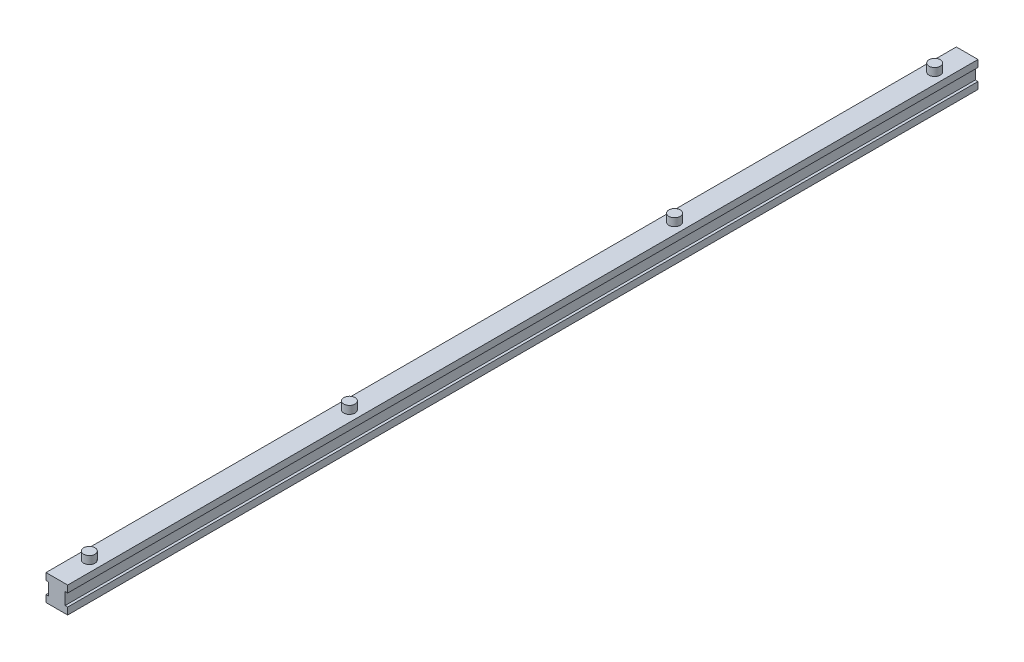
from build123d import *

# Parameters (mm, degrees)
SKETCH1_W           = 2.5
SKETCH1_H           = 105
BOSS_EXTRUDE1_DEPTH = 0.8
SKETCH2_W           = 1.9
SKETCH2_H           = 105
BOSS_EXTRUDE2_DEPTH = 1.4
SKETCH3_W           = 2.5
SKETCH3_H           = 105
BOSS_EXTRUDE3_DEPTH = 0.8
SKETCH4_R           = 0.65
BOSS_EXTRUDE4_DEPTH = 0.9


with BuildPart() as part:
    # Sketch1 → Boss-Extrude1 (new body)
    with BuildSketch(Plane(origin=(0, 0, 0), x_dir=(1, 0, 0), z_dir=(0, 1, 0))):
        Rectangle(SKETCH1_W, SKETCH1_H)
    extrude(amount=BOSS_EXTRUDE1_DEPTH)

    # Sketch2 → Boss-Extrude2 (add)
    with BuildSketch(Plane(origin=(0, 0.8, 0), x_dir=(1, 0, 0), z_dir=(0, 1, 0))):
        Rectangle(SKETCH2_W, SKETCH2_H)
    extrude(amount=BOSS_EXTRUDE2_DEPTH)

    # Sketch3 → Boss-Extrude3 (add)
    with BuildSketch(Plane(origin=(0, 2.2, 0), x_dir=(1, 0, 0), z_dir=(0, 1, 0))):
        Rectangle(SKETCH3_W, SKETCH3_H)
    extrude(amount=BOSS_EXTRUDE3_DEPTH)

    # Sketch4 → Boss-Extrude4 (add)
    with BuildSketch(Plane(origin=(0, 3, 0), x_dir=(1, 0, 0), z_dir=(0, 1, 0))):
        with Locations(Location((0, 18.75, 0), (0, 0, 270))):
            Circle(SKETCH4_R)
        with Locations(Location((0, -18.75, 0), (0, 0, 270))):
            Circle(SKETCH4_R)
        with Locations(Location((0, 48.75, 0), (0, 0, 270))):
            Circle(SKETCH4_R)
        with Locations(Location((0, -48.75, 0), (0, 0, 270))):
            Circle(SKETCH4_R)
    extrude(amount=BOSS_EXTRUDE4_DEPTH)


solid = part.part
